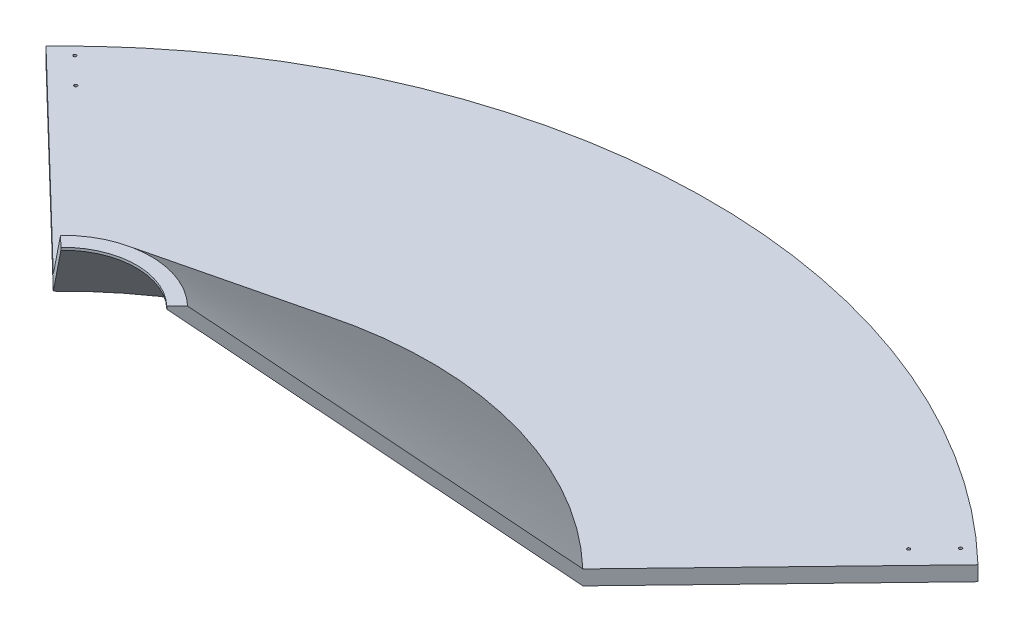
from build123d import *

# Parameters (mm, degrees)
CUT_EXTRUDE_1_DEPTH      = 1636.725546456
CUT_EXTRUDE_1_DEPTH_BACK = 1636.725546456
SKETCH_3_OUTSIDE_W       = 2264.278
SKETCH_3_OUTSIDE_H       = 2264.278
CUT_EXTRUDE_5_DEPTH      = 10
HOLE_WIZARD_M5_1_D       = 4.2


with BuildPart() as part:
    # 草图2 → 旋转1 (revolve)
    with BuildSketch(Plane.XY):
        Polygon((-422.349891291, 6.062538723), (-42.349891291, 6.062538723), (337.650108709, 320.562538723), (357.650108709, 320.562538723), (357.650108709, 317.115170302), (-42.349891291, -13.937461277), (-422.349891291, -13.937461277), align=None)
    revolve(axis=Axis((457.650108709, 481.315085819, 0), (0, -1, 0)))

    # 草图3 outside → 切除-拉伸1 (cut, two sides: drawn at the far end of the back side and taken through both)
    with BuildSketch(Plane(origin=(0, 320.562538723, 0), x_dir=(1, 0, 0), z_dir=(0, 1, 0)).offset(-CUT_EXTRUDE_1_DEPTH_BACK)):
        with Locations((457.65, 0)):
            Rectangle(SKETCH_3_OUTSIDE_W, SKETCH_3_OUTSIDE_H)
        Polygon((457.650108709, 0), (1205.950605112, 776.341843522), (29.226896752, 1910.562473831), (-719.073599651, 1134.220630309), align=None, mode=Mode.SUBTRACT)
    extrude(amount=CUT_EXTRUDE_1_DEPTH + CUT_EXTRUDE_1_DEPTH_BACK, mode=Mode.SUBTRACT)

    # 草图7 → 切除-拉伸5 (cut)
    with BuildSketch(Plane.XZ.offset(13.937461277)):
        Polygon((395.372807922, -667.072096819), (405.372807922, -667.072096819), (406.034922879, -631.072096819), (396.034922879, -631.072096819), (395.7038654, -649.072096819), align=None)
        Polygon((495.686956256, -650.910994037), (496.018013734, -632.910994037), (486.018013734, -632.910994037), (486.018013734, -668.907950391), (495.355954757, -668.907950391), align=None)
    extrude(amount=-CUT_EXTRUDE_5_DEPTH, mode=Mode.SUBTRACT)

    # M5 螺纹孔1 (through all)
    with Locations(Plane(origin=(-145.171244311, 6.062538723, -619.24250439), x_dir=(1, 0, 0), z_dir=(0, 1, 0))):
        with Locations((0, 0), (35.99950912, -34.699212428)):
            hole_wizard_m5_1 = Hole(HOLE_WIZARD_M5_1_D / 2)

    # 镜向1: M5 螺纹孔1 across plane
    add(hole_wizard_m5_1.mirror(Plane(origin=(457.495352358, 0, -8.41429209), x_dir=(0.018388972176112385, 0, 0.9998309085551947), z_dir=(-0.9998309085551947, 0, 0.018388972176112385))), mode=Mode.SUBTRACT)


solid = part.part
